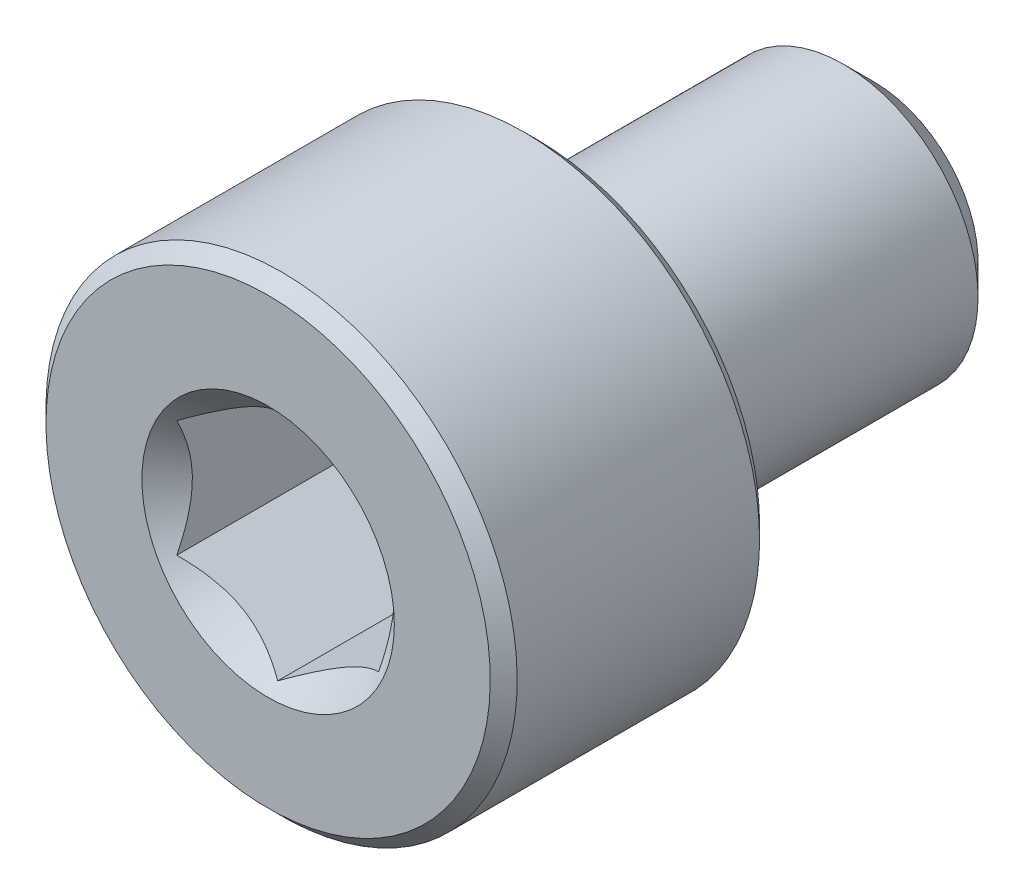
from build123d import *

# Parameters (mm, degrees)
CUT_EXTRUDE1_DEPTH = 3


with BuildPart() as part:
    # Sketch2 → Revolve1 (revolve)
    with BuildSketch(Plane(origin=(0, 0, 0), x_dir=(0, 0, -1), z_dir=(1, 0, 0))):
        with BuildLine():
            Line((-4.5, 0), (-4.5, 3.3))
            Line((-4.5, 3.3), (-4.3, 3.5))
            Line((-4.3, 3.5), (-0.7, 3.5))
            Line((-0.7, 3.5), (-0.5, 3.3))
            Line((-0.5, 3.3), (-0.5, 2.2))
            ThreePointArc((-0.5, 2.2), (-0.441421356, 2.058578644), (-0.3, 2))
            Line((-0.3, 2), (4.045336663, 2))
            Line((4.045336663, 2), (4.5, 1.545336663))
            Line((4.5, 1.545336663), (4.5, 0))
            Line((4.5, 0), (-4.5, 0))
        make_face()
    revolve(axis=Axis((0, 0, -4.5), (0, 0, 1)))

    # Sketch3 → Cut-Extrude1 (cut)
    with BuildSketch(Plane.XY.offset(4.5)):
        Polygon((1.5, -0.866025404), (1.5, 0.866025404), (0, 1.732050808), (-1.5, 0.866025404), (-1.5, -0.866025404), (0, -1.732050808), align=None)
    extrude(amount=-CUT_EXTRUDE1_DEPTH, mode=Mode.SUBTRACT)

    # Cut-Extrude2 cone 1 section (through the dimple's axis) → Cut-Extrude2 (revolve, cut)
    with BuildSketch(Plane(origin=(0, 0, 4.5), x_dir=(0, -1, 0), z_dir=(1, 0, 0))):
        Polygon((0, 0), (1.875, 0), (0, 1.875), align=None)
    revolve(axis=Axis((0, 0, 4.5), (0, 0, -1)), mode=Mode.SUBTRACT)


solid = part.part
